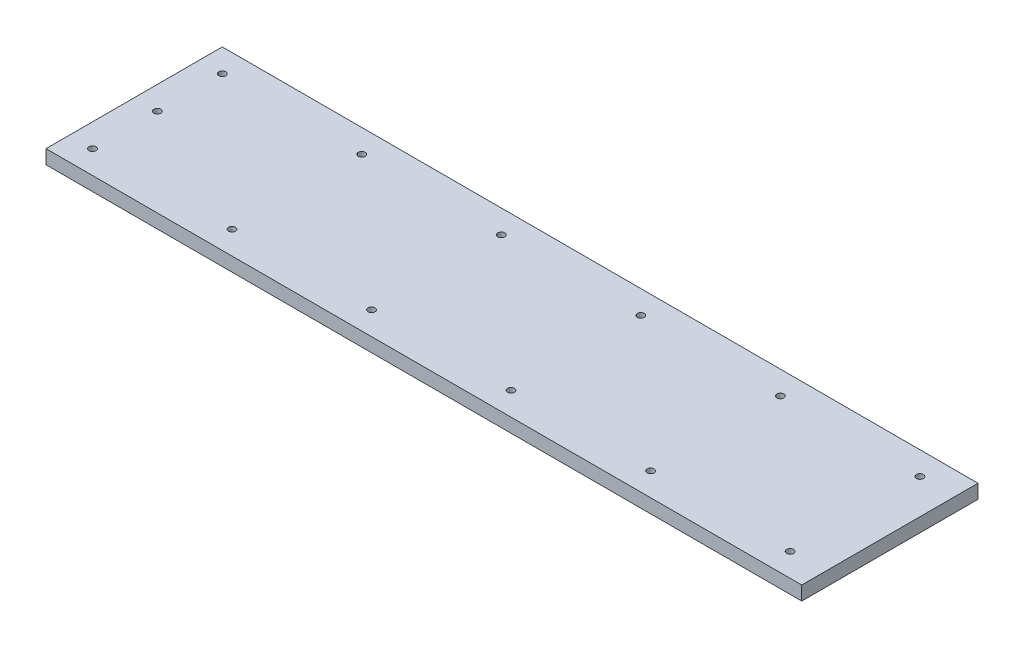
from build123d import *

# Parameters (mm, degrees)
SKETCH_1_W      = 325
SKETCH_1_H      = 75.8
SKETCH_1_R      = 1.5
EXTRUDE_1_DEPTH = 6


with BuildPart() as part:
    # 草图1 → 凸台-拉伸1 (new body)
    with BuildSketch(Plane(origin=(0, 0, 0), x_dir=(1, 0, 0), z_dir=(0, 1, 0))):
        with Locations((0, 27.1)):
            Rectangle(SKETCH_1_W, SKETCH_1_H)
        with Locations(Location((-152.5, 55, 0), (0, 0, 270))):
            Circle(SKETCH_1_R, mode=Mode.SUBTRACT)
        with Locations(Location((-152.5, -0.8, 0), (0, 0, 270))):
            Circle(SKETCH_1_R, mode=Mode.SUBTRACT)
        with Locations(Location((-92.5, 55, 0), (0, 0, 270))):
            Circle(SKETCH_1_R, mode=Mode.SUBTRACT)
        with Locations(Location((-32.5, 55, 0), (0, 0, 270))):
            Circle(SKETCH_1_R, mode=Mode.SUBTRACT)
        with Locations(Location((27.5, 55, 0), (0, 0, 270))):
            Circle(SKETCH_1_R, mode=Mode.SUBTRACT)
        with Locations(Location((87.5, 55, 0), (0, 0, 270))):
            Circle(SKETCH_1_R, mode=Mode.SUBTRACT)
        with Locations(Location((147.5, 55, 0), (0, 0, 270))):
            Circle(SKETCH_1_R, mode=Mode.SUBTRACT)
        with Locations(Location((-92.5, -0.8, 0), (0, 0, 270))):
            Circle(SKETCH_1_R, mode=Mode.SUBTRACT)
        with Locations(Location((-32.5, -0.8, 0), (0, 0, 270))):
            Circle(SKETCH_1_R, mode=Mode.SUBTRACT)
        with Locations(Location((27.5, -0.8, 0), (0, 0, 270))):
            Circle(SKETCH_1_R, mode=Mode.SUBTRACT)
        with Locations(Location((87.5, -0.8, 0), (0, 0, 270))):
            Circle(SKETCH_1_R, mode=Mode.SUBTRACT)
        with Locations(Location((147.5, -0.8, 0), (0, 0, 270))):
            Circle(SKETCH_1_R, mode=Mode.SUBTRACT)
        with Locations(Location((-152.5, 27.1, 0), (0, 0, 270))):
            Circle(SKETCH_1_R, mode=Mode.SUBTRACT)
    extrude(amount=EXTRUDE_1_DEPTH)


solid = part.part
